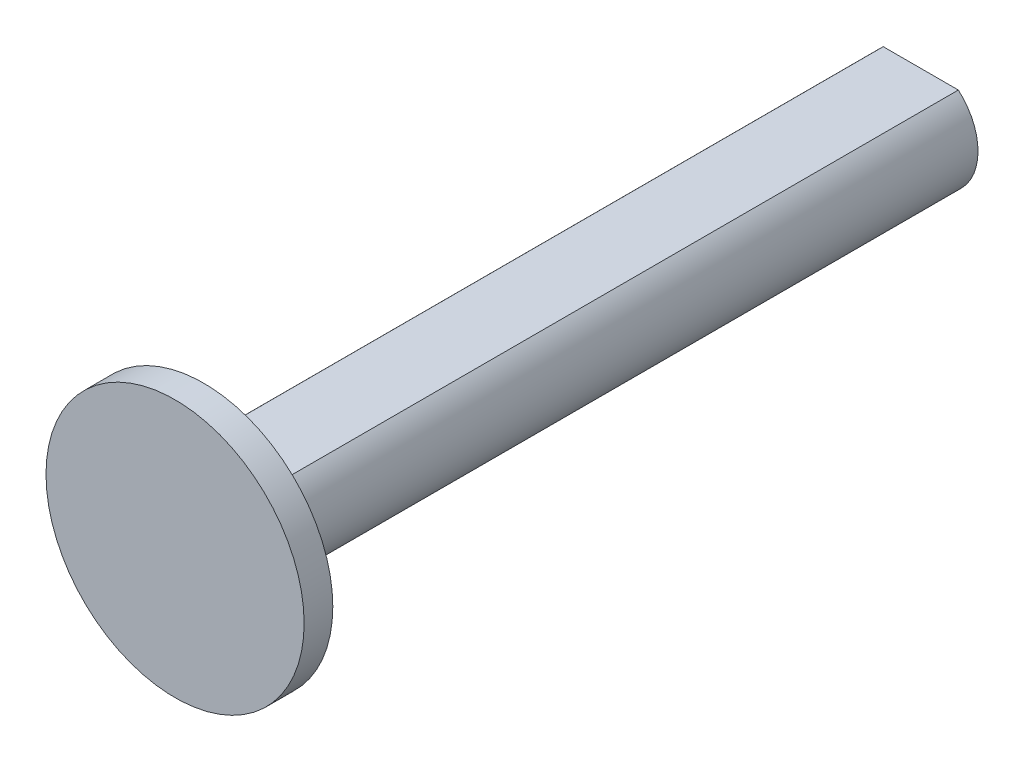
from build123d import *

# Parameters (mm, degrees)
BOSS_EXTRUDE1_DEPTH = 26
ESQUISSE1_R         = 9
BOSS_EXTRU_1_DEPTH  = 2


with BuildPart() as part:
    # Sketch1 → Boss-Extrude1 (new, symmetric)
    with BuildSketch(Plane.XY):
        with BuildLine():
            Line((-2.619160171, 3.01), (2.619160171, 3.01))
            ThreePointArc((2.619160171, 3.01), (0, -3.99), (-2.619160171, 3.01))
        make_face()
    extrude(amount=BOSS_EXTRUDE1_DEPTH, both=True)

    # Esquisse1 → Boss.-Extru.1 (add)
    with BuildSketch(Plane.XY.offset(26)):
        Circle(ESQUISSE1_R)
    extrude(amount=-BOSS_EXTRU_1_DEPTH)


solid = part.part
